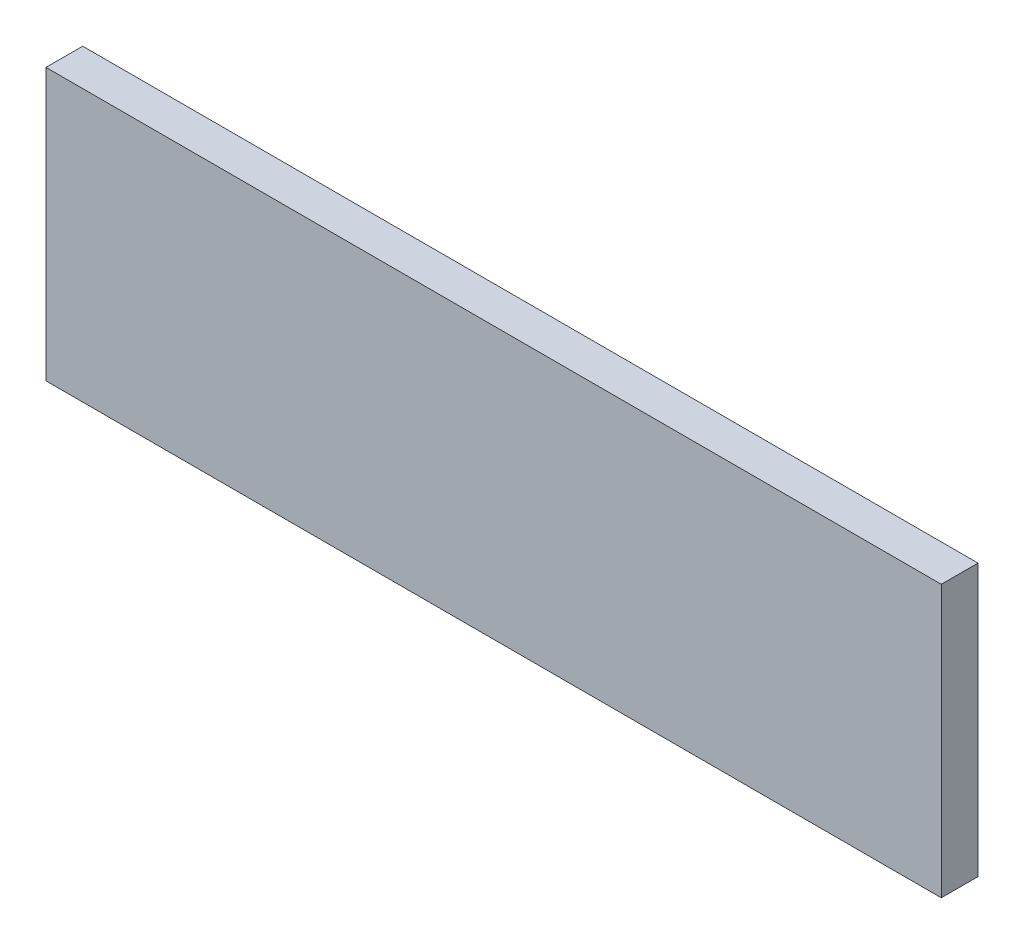
from build123d import *

# Parameters (mm, degrees)
SKETCH1_W           = 244
SKETCH1_H           = 74
BOSS_EXTRUDE1_DEPTH = 10


with BuildPart() as part:
    # Sketch1 → Boss-Extrude1 (new body)
    with BuildSketch(Plane.XY):
        with Locations((55, 30)):
            Rectangle(SKETCH1_W, SKETCH1_H)
    extrude(amount=BOSS_EXTRUDE1_DEPTH)


solid = part.part
